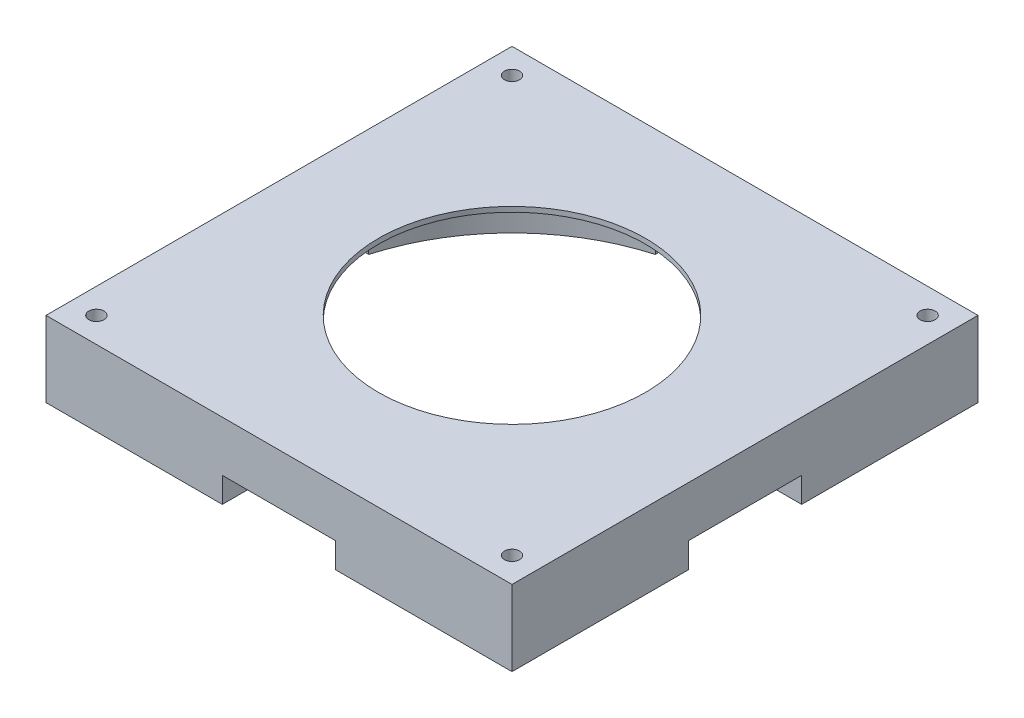
from build123d import *

# Parameters (mm, degrees)
BOSS_EXTRUDE1_START = -30
SKETCH2_W           = 185
SKETCH2_H           = 185
SKETCH2_R           = 85.5
SKETCH2_R_2         = 3
BOSS_EXTRUDE1_DEPTH = 30
SKETCH3_W           = 45
SKETCH3_H           = 10
CUT_EXTRUDE1_DEPTH  = 210.000598085
SKETCH4_W           = 45
SKETCH4_H           = 10
CUT_EXTRUDE2_DEPTH  = 210.000598085


with BuildPart() as part:
    # Sketch1 → Revolve1 (revolve)
    with BuildSketch(Plane.XY, mode=Mode.PRIVATE) as revolve1_sk:
        Polygon((53, -2), (82.5, -2), (82.5, -30), (85.5, -30), (85.5, 0), (53, 0), align=None)
    revolve(revolve1_sk.sketch.rotate(Axis((0, 0, 0), (0, -1, 0)), 90), axis=Axis((0, 0, 0), (0, -1, 0)))

    # Sketch2 → Boss-Extrude1 (add)
    with BuildSketch(Plane.XZ.offset(30).offset(BOSS_EXTRUDE1_START)):
        Rectangle(SKETCH2_W, SKETCH2_H)
        Circle(SKETCH2_R, mode=Mode.SUBTRACT)
        with Locations(Location((-82.5, -82.5, 0), (0, 0, 270))):
            Circle(SKETCH2_R_2, mode=Mode.SUBTRACT)
        with Locations(Location((82.5, -82.5, 0), (0, 0, 270))):
            Circle(SKETCH2_R_2, mode=Mode.SUBTRACT)
        with Locations(Location((82.5, 82.5, 0), (0, 0, 270))):
            Circle(SKETCH2_R_2, mode=Mode.SUBTRACT)
        with Locations(Location((-82.5, 82.5, 0), (0, 0, 270))):
            Circle(SKETCH2_R_2, mode=Mode.SUBTRACT)
    extrude(amount=BOSS_EXTRUDE1_DEPTH)

    # Sketch3 → Cut-Extrude1 (cut, through all)
    with BuildSketch(Plane.ZY.offset(92.5)):
        with Locations((0, -25)):
            Rectangle(SKETCH3_W, SKETCH3_H)
    extrude(amount=-CUT_EXTRUDE1_DEPTH, mode=Mode.SUBTRACT)

    # Sketch4 → Cut-Extrude2 (cut, through all)
    with BuildSketch(Plane(origin=(0, 0, -92.5), x_dir=(-1, 0, 0), z_dir=(0, 0, -1))):
        with Locations((0, -25)):
            Rectangle(SKETCH4_W, SKETCH4_H)
    extrude(amount=-CUT_EXTRUDE2_DEPTH, mode=Mode.SUBTRACT)


solid = part.part
